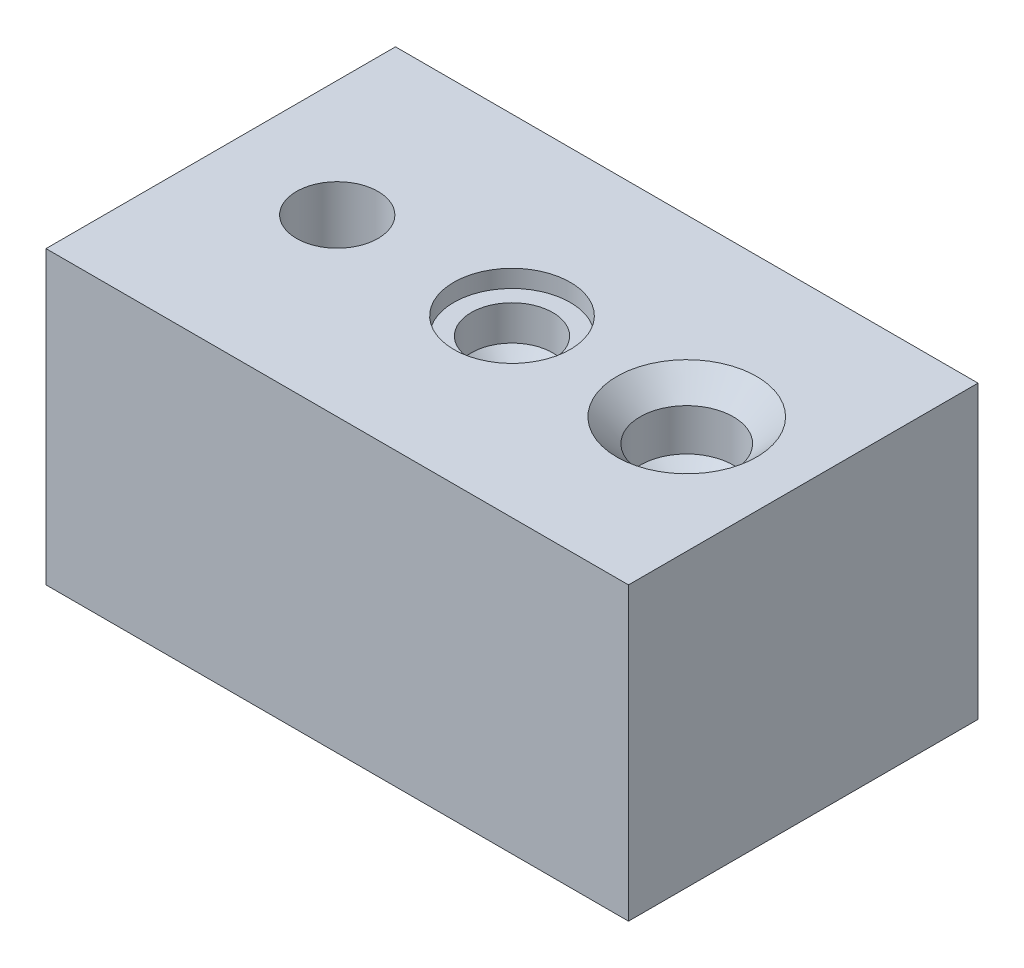
from build123d import *

# Parameters (mm, degrees)
ESBO_O2_W                                 = 100
ESBO_O2_H                                 = 60
RESSALTO_EXTRUS_O1_DEPTH                  = 50
FURO1_D                                   = 14
FURO1_DEPTH                               = 9
FURO1_CBORE_D                             = 20
FURO1_CBORE_DEPTH                         = 3
FURO1_TIP                                 = 7
FURO2_D                                   = 16
FURO2_DEPTH                               = 11.193115048
FURO2_CSINK_D                             = 24
FURO2_CSINK_ANGLE                         = 90
FURO2_TIP                                 = 4.806884952
BROCA_DE_ROSQUEAR_PARA_TARRAXA_DE_M16X2_D = 14


with BuildPart() as part:
    # Esboço2 → Ressalto-extrusão1 (new body)
    with BuildSketch(Plane(origin=(0, 0, 0), x_dir=(1, 0, 0), z_dir=(0, 1, 0))):
        with Locations((-50, 30)):
            Rectangle(ESBO_O2_W, ESBO_O2_H)
    extrude(amount=RESSALTO_EXTRUS_O1_DEPTH)

    # Furo1
    with Locations(Plane(origin=(0, 50, 0), x_dir=(1, 0, 0), z_dir=(0, 1, 0))):
        with Locations((-50, 30)):
            CounterBoreHole(FURO1_D / 2, FURO1_CBORE_D / 2, FURO1_CBORE_DEPTH, depth=FURO1_DEPTH)
            with Locations((0, 0, -(FURO1_DEPTH + FURO1_TIP / 2))):  # 90° drill point
                Cone(0, FURO1_D / 2, FURO1_TIP, mode=Mode.SUBTRACT)

    # Furo2
    with Locations(Plane(origin=(0, 50, 0), x_dir=(1, 0, 0), z_dir=(0, 1, 0))):
        with Locations((-20, 30)):
            CounterSinkHole(FURO2_D / 2, FURO2_CSINK_D / 2, depth=FURO2_DEPTH, counter_sink_angle=FURO2_CSINK_ANGLE)
            with Locations((0, 0, -(FURO2_DEPTH + FURO2_TIP / 2))):  # 118° drill point
                Cone(0, FURO2_D / 2, FURO2_TIP, mode=Mode.SUBTRACT)

    # Broca de rosquear para tarraxa de M16x2.02 (through all)
    with Locations(Plane(origin=(0, 50, 0), x_dir=(1, 0, 0), z_dir=(0, 1, 0))):
        with Locations((-80, 30)):
            Hole(BROCA_DE_ROSQUEAR_PARA_TARRAXA_DE_M16X2_D / 2)


solid = part.part
